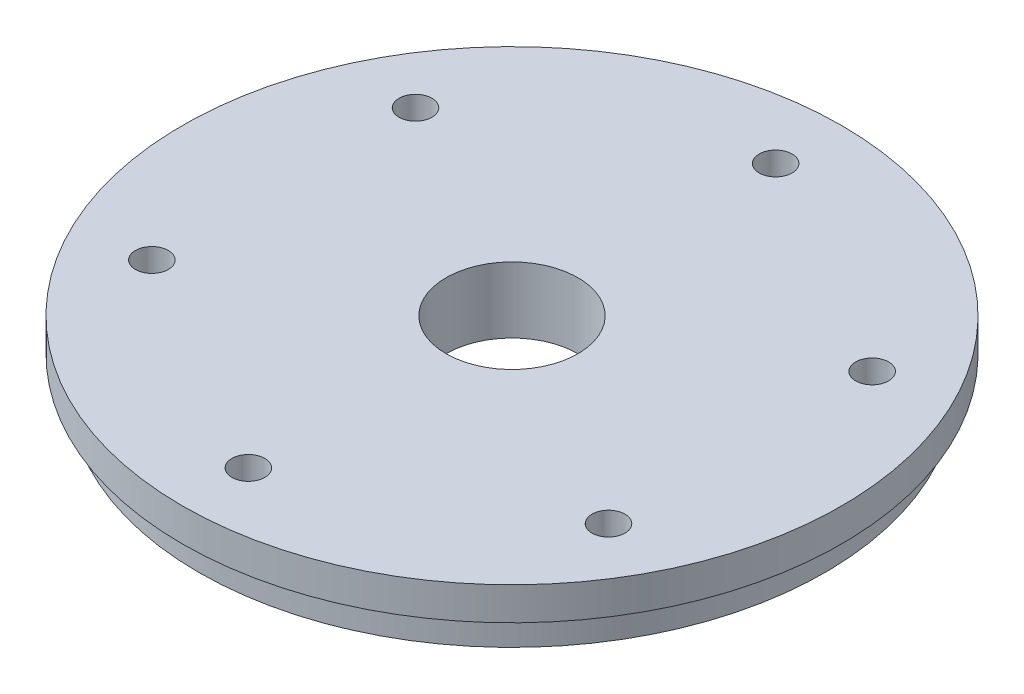
from build123d import *

# Parameters (mm, degrees)
SKETCH1_R           = 30.1625
BOSS_EXTRUDE1_DEPTH = 3.175
SKETCH2_R           = 31.75
BOSS_EXTRUDE2_DEPTH = 3.175
SKETCH3_R           = 1.5875
SKETCH3_R_2         = 6.35
CUT_EXTRUDE1_DEPTH  = 46.348070521


with BuildPart() as part:
    # Sketch1 → Boss-Extrude1 (new body)
    with BuildSketch(Plane(origin=(0, 0, 0), x_dir=(1, 0, 0), z_dir=(0, 1, 0))):
        with Locations(Location((0, 0, 0), (0, 0, 270))):
            Circle(SKETCH1_R)
    extrude(amount=BOSS_EXTRUDE1_DEPTH)

    # Sketch2 → Boss-Extrude2 (add)
    with BuildSketch(Plane(origin=(0, 3.175, 0), x_dir=(1, 0, 0), z_dir=(0, 1, 0))):
        with Locations(Location((0, 0, 0), (0, 0, 270))):
            Circle(SKETCH2_R)
    extrude(amount=BOSS_EXTRUDE2_DEPTH)

    # Sketch3 → Cut-Extrude1 (cut, through all)
    with BuildSketch(Plane(origin=(0, 6.35, 0), x_dir=(1, 0, 0), z_dir=(0, 1, 0))):
        with Locations(Location((0, 25.4, 0), (0, 0, 270))):
            Circle(SKETCH3_R)
        with Locations(Location((21.997045256, 12.7, 0), (0, 0, 270))):
            Circle(SKETCH3_R)
        with Locations(Location((21.997045256, -12.7, 0), (0, 0, 270))):
            Circle(SKETCH3_R)
        with Locations(Location((0, -25.4, 0), (0, 0, 270))):
            Circle(SKETCH3_R)
        with Locations(Location((-21.997045256, -12.7, 0), (0, 0, 270))):
            Circle(SKETCH3_R)
        with Locations(Location((-21.997045256, 12.7, 0), (0, 0, 270))):
            Circle(SKETCH3_R)
        with Locations(Location((0, 0, 0), (0, 0, 270))):
            Circle(SKETCH3_R_2)
    extrude(amount=-CUT_EXTRUDE1_DEPTH, mode=Mode.SUBTRACT)


solid = part.part
